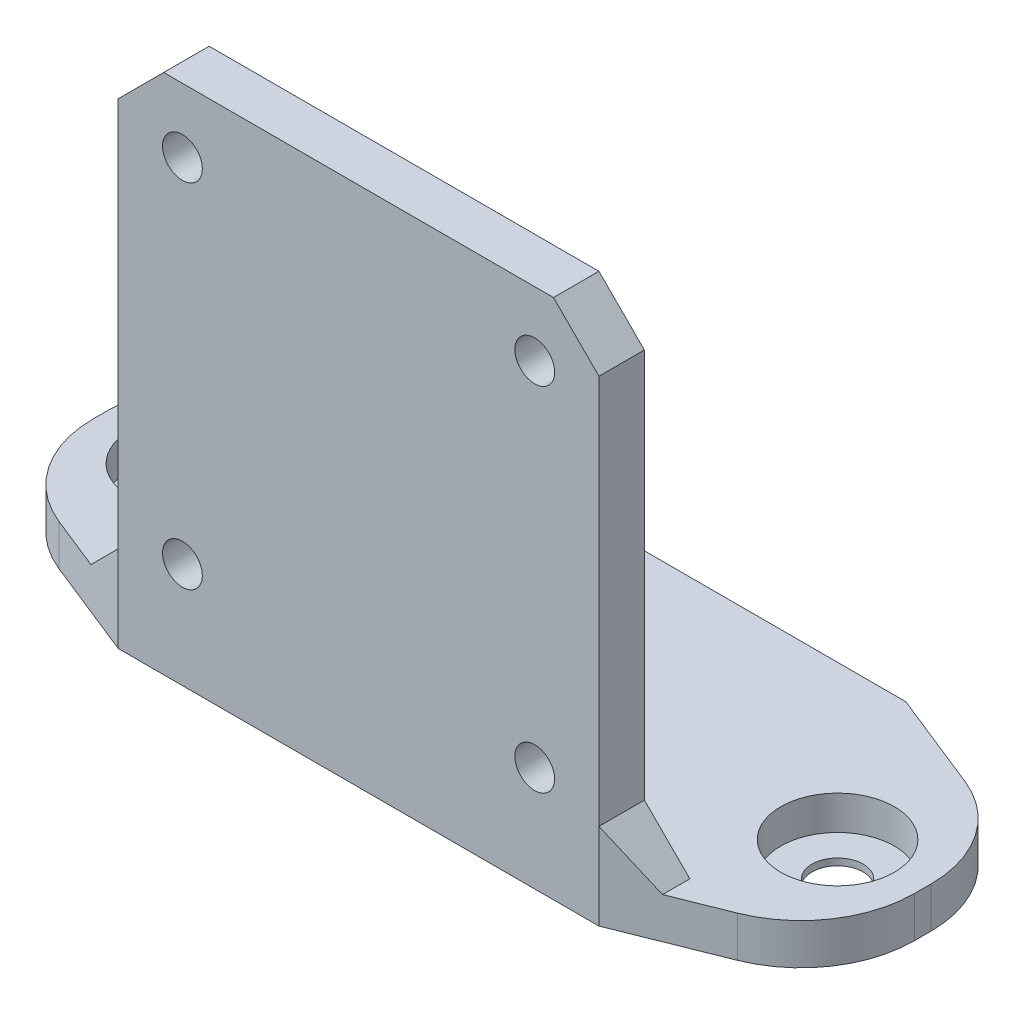
from build123d import *

# Parameters (mm, degrees)
SCHIZZO2_W                                           = 72.3
SCHIZZO2_H                                           = 27
ESTRUSIONE_ESTRUSIONE1_DEPTH                         = 3.6
SCHIZZO3_W                                           = 42.3
SCHIZZO3_H                                           = 4
ESTRUSIONE_ESTRUSIONE2_DEPTH                         = 42.3
SCHIZZO4_R                                           = 1.75
TAGLIO_ESTRUSIONE1_DEPTH                             = 42.3
FORO_LAMATO_PER_VITE_M4_A_TESTA_CILINDRI_D           = 4.5
FORO_LAMATO_PER_VITE_M4_A_TESTA_CILINDRI_DEPTH       = 9
FORO_LAMATO_PER_VITE_M4_A_TESTA_CILINDRI_CBORE_D     = 10
FORO_LAMATO_PER_VITE_M4_A_TESTA_CILINDRI_CBORE_DEPTH = 3
FORO_LAMATO_PER_VITE_M4_A_TESTA_CILINDRI_TIP         = 1.351936393
TAGLIO_ESTRUSIONE2_DEPTH                             = 42.3
SMUSSO1_SIZE                                         = 4
RACCORDO1_R                                          = 10
SMUSSO2_SIZE                                         = 4


with BuildPart() as part:
    # Schizzo2 → Estrusione-Estrusione1 (new body)
    with BuildSketch(Plane(origin=(0, 0, 0), x_dir=(1, 0, 0), z_dir=(0, 1, 0))):
        with Locations((36.15, -13.5)):
            Rectangle(SCHIZZO2_W, SCHIZZO2_H)
    extrude(amount=ESTRUSIONE_ESTRUSIONE1_DEPTH)

    # Schizzo3 → Estrusione-Estrusione2 (add)
    with BuildSketch(Plane(origin=(0, 3.6, 0), x_dir=(1, 0, 0), z_dir=(0, 1, 0))):
        with Locations((36.15, -25)):
            Rectangle(SCHIZZO3_W, SCHIZZO3_H)
    extrude(amount=ESTRUSIONE_ESTRUSIONE2_DEPTH)

    # Schizzo4 → Taglio-Estrusione1 (cut)
    with BuildSketch(Plane.XY.offset(27)):
        with Locations((20.65, 40.25)):
            Circle(SCHIZZO4_R)
        with Locations((51.65, 40.25)):
            Circle(SCHIZZO4_R)
        with Locations((51.65, 9.25)):
            Circle(SCHIZZO4_R)
        with Locations((20.65, 9.25)):
            Circle(SCHIZZO4_R)
    extrude(amount=-TAGLIO_ESTRUSIONE1_DEPTH, mode=Mode.SUBTRACT)

    # Foro lamato per Vite M4 a testa cilindrica-2
    with Locations(Plane(origin=(0, 3.6, 0), x_dir=(1, 0, 0), z_dir=(0, 1, 0))):
        with Locations((7.5, -13.5), (64.8, -13.5)):
            CounterBoreHole(FORO_LAMATO_PER_VITE_M4_A_TESTA_CILINDRI_D / 2, FORO_LAMATO_PER_VITE_M4_A_TESTA_CILINDRI_CBORE_D / 2, FORO_LAMATO_PER_VITE_M4_A_TESTA_CILINDRI_CBORE_DEPTH, depth=FORO_LAMATO_PER_VITE_M4_A_TESTA_CILINDRI_DEPTH)
            with Locations((0, 0, -(FORO_LAMATO_PER_VITE_M4_A_TESTA_CILINDRI_DEPTH + FORO_LAMATO_PER_VITE_M4_A_TESTA_CILINDRI_TIP / 2))):  # 118° drill point
                Cone(0, FORO_LAMATO_PER_VITE_M4_A_TESTA_CILINDRI_D / 2, FORO_LAMATO_PER_VITE_M4_A_TESTA_CILINDRI_TIP, mode=Mode.SUBTRACT)

    # Schizzo8 → Taglio-Estrusione2 (cut)
    with BuildSketch(Plane(origin=(0, 3.6, 0), x_dir=(1, 0, 0), z_dir=(0, 1, 0))):
        Polygon((15, -27), (0, -21), (0, -27), align=None)
        Polygon((0, -6), (0, 0), (15, 0), align=None)
        Polygon((57.3, 0), (72.3, 0), (72.3, -6), align=None)
        Polygon((57.3, -27), (72.3, -27), (72.3, -21), align=None)
    extrude(amount=-TAGLIO_ESTRUSIONE2_DEPTH, mode=Mode.SUBTRACT)

    # Smusso1
    smusso1_edges = [part.edges().sort_by_distance(p)[0] for p in [
        (15, 45.9, 25),
        (57.3, 45.9, 25),
    ]]
    chamfer(smusso1_edges, length=SMUSSO1_SIZE)

    # Raccordo1
    raccordo1_edges = [part.edges().sort_by_distance(p)[0] for p in [
        (0, 1.8, 21),
        (72.3, 1.8, 21),
        (72.3, 1.8, 6),
        (0, 1.8, 6),
    ]]
    fillet(raccordo1_edges, radius=RACCORDO1_R)

    # Smusso2
    smusso2_edges = [part.edges().sort_by_distance(p)[0] for p in [
        (15, 3.6, 25),
        (57.3, 3.6, 25),
    ]]
    chamfer(smusso2_edges, length=SMUSSO2_SIZE)


solid = part.part
